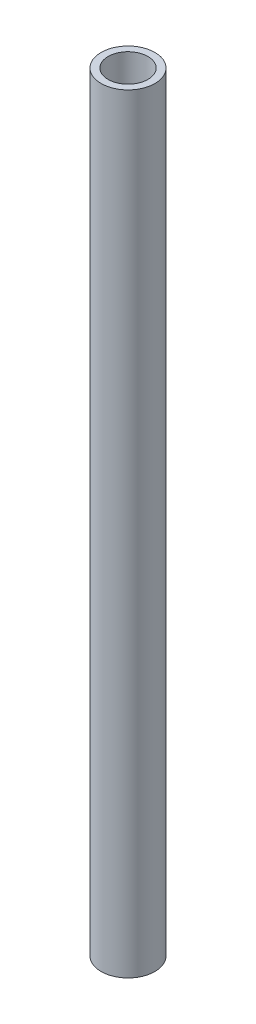
from build123d import *

# Parameters (mm, degrees)
SKETCH1_R           = 10.668
SKETCH1_R_2         = 7.8994
BOSS_EXTRUDE1_DEPTH = 304.8


with BuildPart() as part:
    # Sketch1 → Boss-Extrude1 (new body)
    with BuildSketch(Plane(origin=(0, 0, 0), x_dir=(1, 0, 0), z_dir=(0, 1, 0))):
        with Locations(Location((0, 0, 0), (0, 0, 90))):
            Circle(SKETCH1_R)
        with Locations(Location((0, 0, 0), (0, 0, 90))):
            Circle(SKETCH1_R_2, mode=Mode.SUBTRACT)
    extrude(amount=BOSS_EXTRUDE1_DEPTH)


solid = part.part
